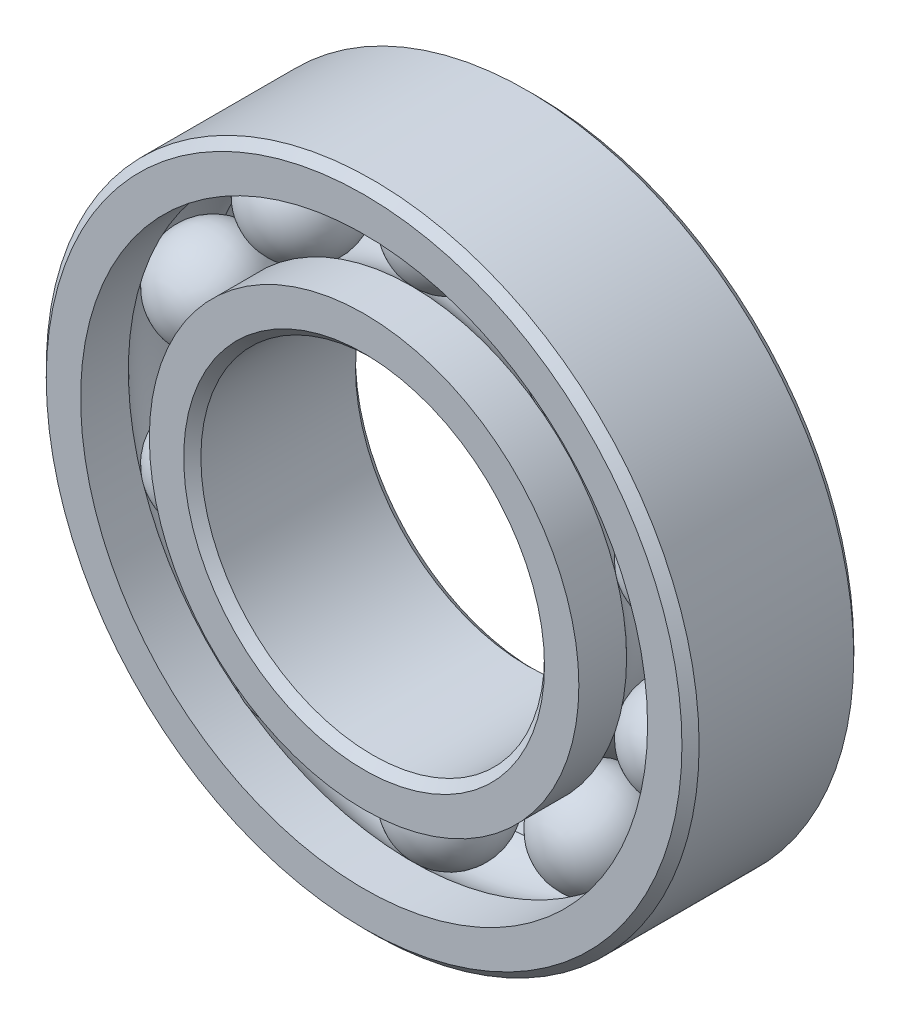
from build123d import *

# Parameters (mm, degrees)
CIRPATTERN1_COUNT = 10


with BuildPart() as part:
    # Sketch5 → Revolve1 (revolve)
    with BuildSketch(Plane(origin=(0, 0, 0), x_dir=(0, 0, -1), z_dir=(1, 0, 0))):
        with BuildLine():
            Line((2.25, 9.5), (-2.25, 9.5))
            Line((-2.25, 9.5), (-2.5, 9.25))
            Line((-2.5, 9.25), (-2.5, 8.25))
            Line((-2.5, 8.25), (-1.111111111, 8.25))
            ThreePointArc((-1.111111111, 8.25), (0, 8.744847116), (1.111111111, 8.25))
            Line((1.111111111, 8.25), (2.5, 8.25))
            Line((2.5, 8.25), (2.5, 9.25))
            Line((2.5, 9.25), (2.25, 9.5))
        make_face()
    revolve(axis=Axis((0, 0, 2.5), (0, 0, -1)))


with BuildPart() as body_2:
    # Sketch3 → Revolve3 (revolve)
    with BuildSketch(Plane(origin=(0, 0, 0), x_dir=(0, 0, -1), z_dir=(1, 0, 0))):
        with BuildLine():
            Line((-2.5, 6.25), (-1.111111111, 6.25))
            ThreePointArc((-1.111111111, 6.25), (0, 5.755152884), (1.111111111, 6.25))
            Line((1.111111111, 6.25), (2.5, 6.25))
            Line((2.5, 6.25), (2.5, 5.25))
            Line((2.5, 5.25), (2.25, 5))
            Line((2.25, 5), (-2.25, 5))
            Line((-2.25, 5), (-2.5, 5.25))
            Line((-2.5, 5.25), (-2.5, 6.25))
        make_face()
    revolve(axis=Axis((0, 0, 2.5), (0, 0, -1)))


with BuildPart() as body_3:
    # Sketch4 → Revolve4 (revolve)
    with BuildSketch(Plane(origin=(0, 0, 0), x_dir=(0, 0, -1), z_dir=(1, 0, 0))):
        with BuildLine():
            Line((-1.494847116, 7.25), (1.494847116, 7.25))
            ThreePointArc((1.494847116, 7.25), (0, 8.744847116), (-1.494847116, 7.25))
        make_face()
    revolve(axis=Axis((0, 7.25, 1.494847116), (0, 0, -1)))


with BuildPart() as cirpattern1_1:
    # CirPattern1: pattern copy
    add(body_3.part.rotate(Axis((0, 0, 0), (0, 0, 1)), 1 * 360 / CIRPATTERN1_COUNT))


with BuildPart() as cirpattern1_2:
    # CirPattern1: pattern copy
    add(body_3.part.rotate(Axis((0, 0, 0), (0, 0, 1)), 2 * 360 / CIRPATTERN1_COUNT))


with BuildPart() as cirpattern1_3:
    # CirPattern1: pattern copy
    add(body_3.part.rotate(Axis((0, 0, 0), (0, 0, 1)), 3 * 360 / CIRPATTERN1_COUNT))


with BuildPart() as cirpattern1_4:
    # CirPattern1: pattern copy
    add(body_3.part.rotate(Axis((0, 0, 0), (0, 0, 1)), 4 * 360 / CIRPATTERN1_COUNT))


with BuildPart() as cirpattern1_5:
    # CirPattern1: pattern copy
    add(body_3.part.rotate(Axis((0, 0, 0), (0, 0, 1)), 5 * 360 / CIRPATTERN1_COUNT))


with BuildPart() as cirpattern1_6:
    # CirPattern1: pattern copy
    add(body_3.part.rotate(Axis((0, 0, 0), (0, 0, 1)), 6 * 360 / CIRPATTERN1_COUNT))


with BuildPart() as cirpattern1_7:
    # CirPattern1: pattern copy
    add(body_3.part.rotate(Axis((0, 0, 0), (0, 0, 1)), 7 * 360 / CIRPATTERN1_COUNT))


with BuildPart() as cirpattern1_8:
    # CirPattern1: pattern copy
    add(body_3.part.rotate(Axis((0, 0, 0), (0, 0, 1)), 8 * 360 / CIRPATTERN1_COUNT))


with BuildPart() as cirpattern1_9:
    # CirPattern1: pattern copy
    add(body_3.part.rotate(Axis((0, 0, 0), (0, 0, 1)), 9 * 360 / CIRPATTERN1_COUNT))


solid = Compound([part.part, body_2.part, body_3.part, cirpattern1_1.part, cirpattern1_2.part, cirpattern1_3.part, cirpattern1_4.part, cirpattern1_5.part, cirpattern1_6.part, cirpattern1_7.part, cirpattern1_8.part, cirpattern1_9.part])
